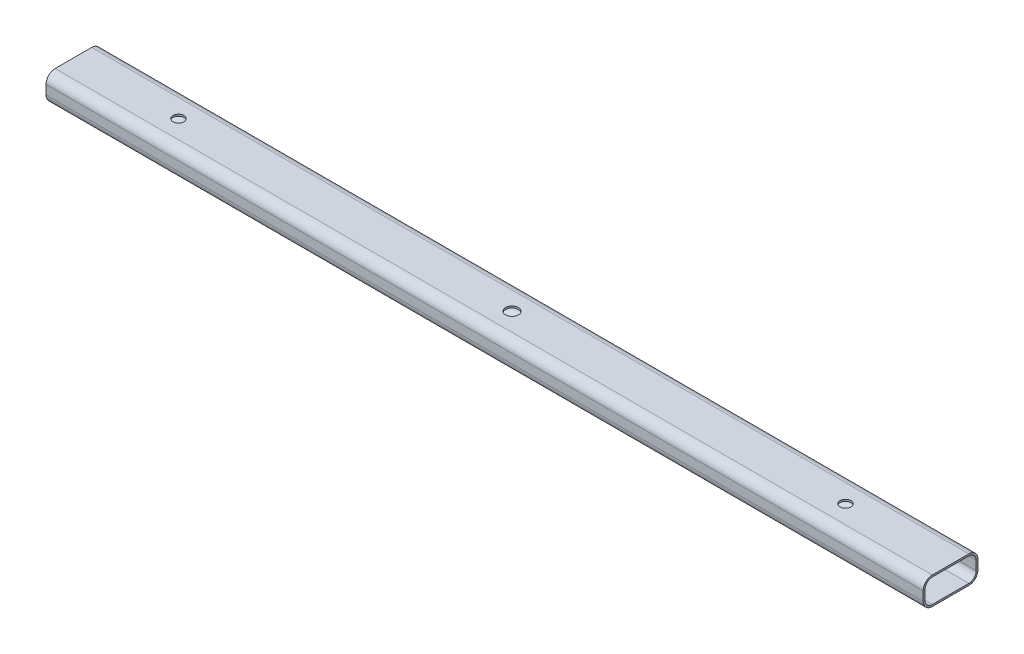
from build123d import *

# Parameters (mm, degrees)
EXTRUDE_1_DEPTH     = 480
SKETCH_2_R          = 3.5
SKETCH_2_R_2        = 3
CUT_EXTRUDE_1_DEPTH = 481.468521341


with BuildPart() as part:
    # Эскиз1 → Вытянуть-Тонкостенный1 (new body)
    with BuildSketch(Plane(origin=(0, 0, 0), x_dir=(0, 0, -1), z_dir=(1, 0, 0))):
        with BuildLine():
            Line((10, 7.5), (-10, 7.5))
            ThreePointArc((-10, 7.5), (-13.535533906, 6.035533906), (-15, 2.5))
            Line((-15, 2.5), (-15, -2.5))
            ThreePointArc((-15, -2.5), (-13.535533906, -6.035533906), (-10, -7.5))
            Line((-10, -7.5), (10, -7.5))
            ThreePointArc((10, -7.5), (13.535533906, -6.035533906), (15, -2.5))
            Line((15, -2.5), (15, 2.5))
            ThreePointArc((15, 2.5), (13.535533906, 6.035533906), (10, 7.5))
        make_face()
        with BuildLine():
            Line((10, 6.5), (-10, 6.5))
            ThreePointArc((-10, 6.5), (-12.828427125, 5.328427125), (-14, 2.5))
            Line((-14, 2.5), (-14, -2.5))
            ThreePointArc((-14, -2.5), (-12.828427125, -5.328427125), (-10, -6.5))
            Line((-10, -6.5), (10, -6.5))
            ThreePointArc((10, -6.5), (12.828427125, -5.328427125), (14, -2.5))
            Line((14, -2.5), (14, 2.5))
            ThreePointArc((14, 2.5), (12.828427125, 5.328427125), (10, 6.5))
        make_face(mode=Mode.SUBTRACT)
    extrude(amount=EXTRUDE_1_DEPTH)

    # Эскиз2 → Вырез-Вытянуть1 (cut, through all)
    with BuildSketch(Plane(origin=(0, 7.5, 0), x_dir=(1, 0, 0), z_dir=(0, 1, 0))):
        with Locations(Location((240, 0, 0), (0, 0, 270))):
            Circle(SKETCH_2_R)
        with Locations(Location((57.5, 0, 0), (0, 0, 270))):
            Circle(SKETCH_2_R_2)
        with Locations(Location((422.5, 0, 0), (0, 0, 90))):
            Circle(SKETCH_2_R_2)
    extrude(amount=-CUT_EXTRUDE_1_DEPTH, mode=Mode.SUBTRACT)


solid = part.part
